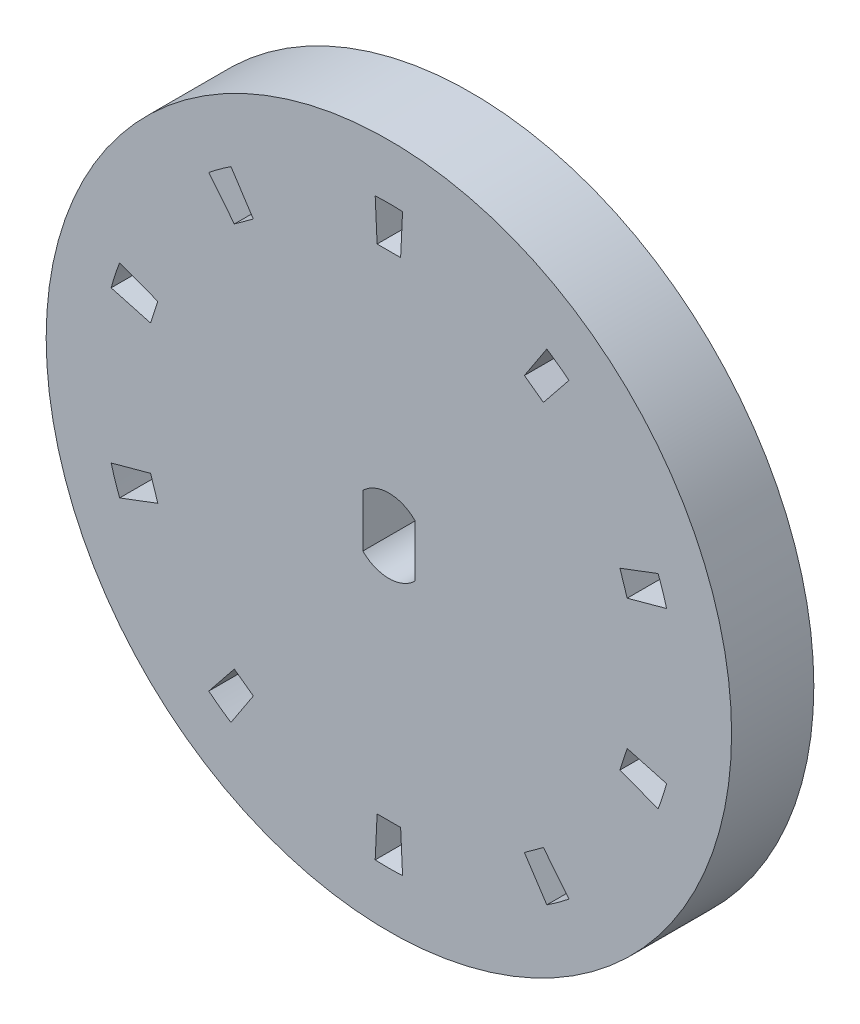
from build123d import *

# Parameters (mm, degrees)
SKETCH2_R           = 25
BOSS_EXTRUDE1_DEPTH = 4
SKETCH3_R           = 25
SKETCH3_R_2         = 1
BOSS_EXTRUDE2_DEPTH = 2
CUT_EXTRUDE1_DEPTH  = 36.860842154
CIRPATTERN1_COUNT   = 10


with BuildPart() as part:
    # Sketch2 → Boss-Extrude1 (new body)
    with BuildSketch(Plane.XY):
        Circle(SKETCH2_R)
        with BuildLine():
            Line((1.9, -1.918332609), (1.9, 1.918332609))
            ThreePointArc((1.9, 1.918332609), (0, 2.7), (-1.9, 1.918332609))
            Line((-1.9, 1.918332609), (-1.9, -1.918332609))
            ThreePointArc((-1.9, -1.918332609), (0, -2.7), (1.9, -1.918332609))
        make_face(mode=Mode.SUBTRACT)
    extrude(amount=-BOSS_EXTRUDE1_DEPTH)

    # Sketch3 → Boss-Extrude2 (add)
    with BuildSketch(Plane(origin=(0, 0, -4), x_dir=(-1, 0, 0), z_dir=(0, 0, -1))):
        with Locations(Location((0, 0, 0), (0, 0, 180))):
            Circle(SKETCH3_R)
        Circle(SKETCH3_R_2, mode=Mode.SUBTRACT)
    extrude(amount=BOSS_EXTRUDE2_DEPTH)

    # Sketch4 → Cut-Extrude1 (cut, symmetric)
    with BuildSketch(Plane.XY):
        with BuildLine():
            Line((-0.857142857, 18), (0.857142857, 18))
            Line((0.857142857, 18), (0.998868138, 20.976230892))
            ThreePointArc((0.998868138, 20.976230892), (0, 21), (-0.998868138, 20.976230892))
            Line((-0.998868138, 20.976230892), (-0.857142857, 18))
        make_face()
    cut_extrude1 = extrude(amount=CUT_EXTRUDE1_DEPTH, both=True, mode=Mode.SUBTRACT)

    # CirPattern1: Cut-Extrude1 ×10 about axis
    cirpattern1_axis = Axis((0, 0, 0), (0, 0, 1))
    for i in range(1, CIRPATTERN1_COUNT):
        add(cut_extrude1.rotate(cirpattern1_axis, i * 360 / CIRPATTERN1_COUNT), mode=Mode.SUBTRACT)


solid = part.part
